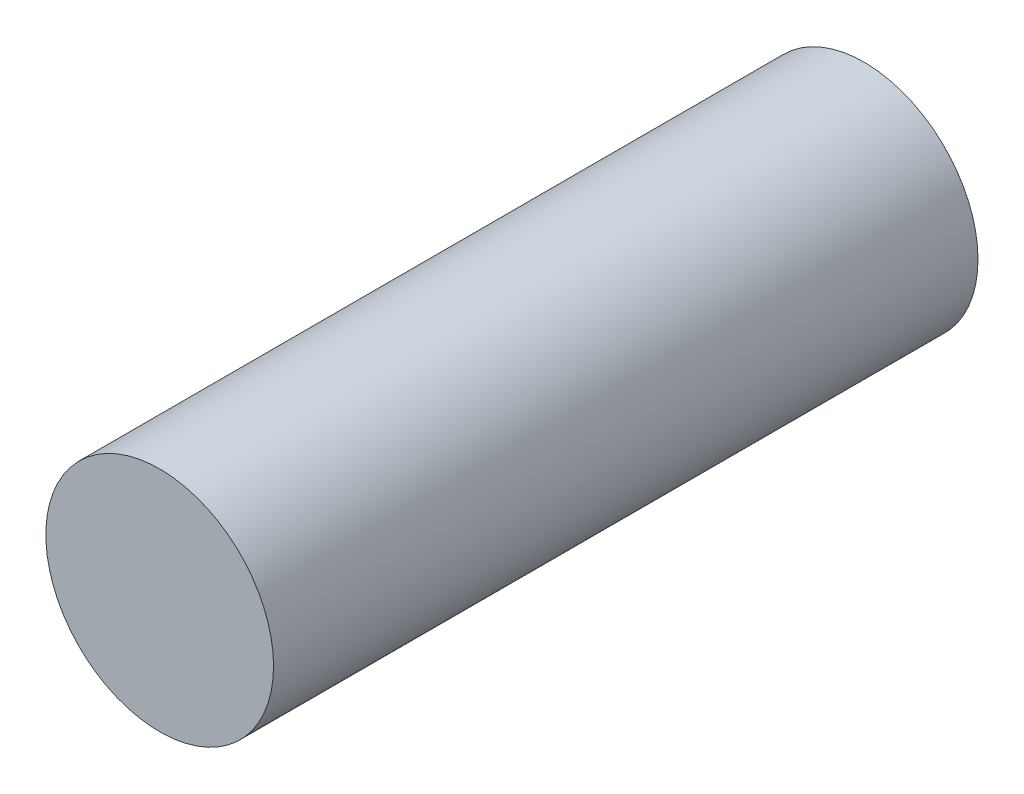
from build123d import *

# Parameters (mm, degrees)
SKETCH_1_R      = 0.323232354
EXTRUDE_1_DEPTH = 1


with BuildPart() as part:
    # 草图1 → 凸台-拉伸1 (new, symmetric)
    with BuildSketch(Plane.XY):
        with Locations((-1, 0)):
            Circle(SKETCH_1_R)
    extrude(amount=EXTRUDE_1_DEPTH, both=True)


solid = part.part
